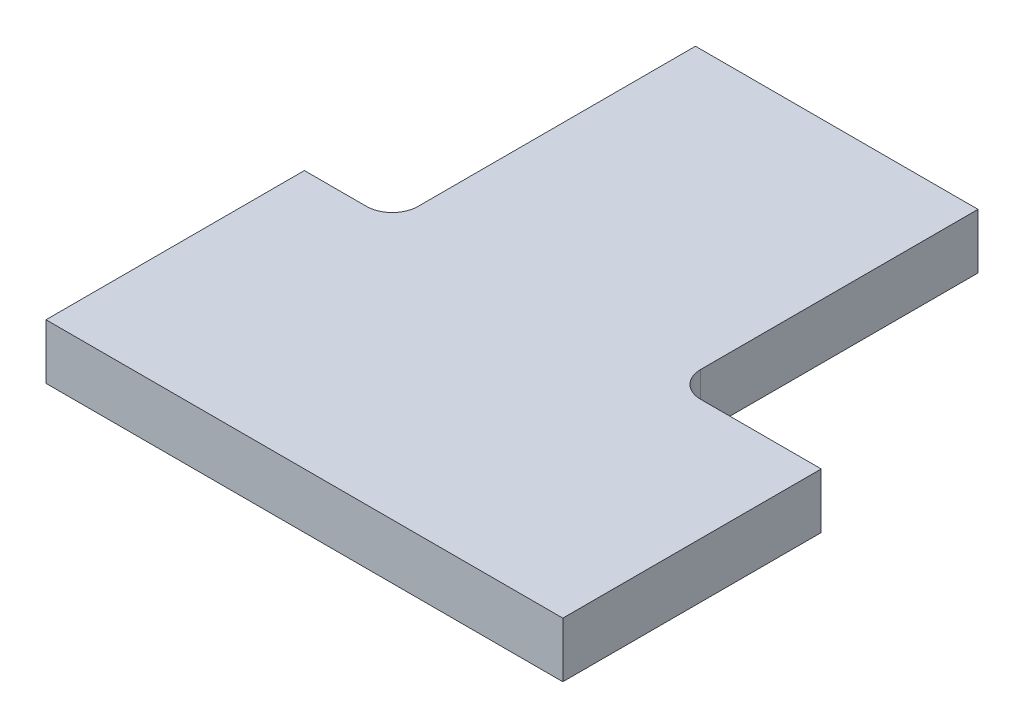
from build123d import *

# Parameters (mm, degrees)
AUFSATZ_LINEAR_AUSTRAGEN1_DEPTH = 1.6


with BuildPart() as part:
    # Skizze1 → Aufsatz-Linear austragen1 (new body)
    with BuildSketch(Plane(origin=(0, 0, 0), x_dir=(1, 0, 0), z_dir=(0, 1, 0))):
        with BuildLine():
            Line((4.85, 3.75), (4, 3.75))
            ThreePointArc((4, 3.75), (3.469669914, 3.969669914), (3.25, 4.5))
            Line((3.25, 4.5), (3.25, 12.55))
            Line((3.25, 12.55), (-4.95, 12.55))
            Line((-4.95, 12.55), (-4.95, 4.5))
            ThreePointArc((-4.95, 4.5), (-5.169669914, 3.969669914), (-5.7, 3.75))
            Line((-5.7, 3.75), (-7.5, 3.75))
            Line((-7.5, 3.75), (-7.5, -3.75))
            Line((-7.5, -3.75), (7.5, -3.75))
            Line((7.5, -3.75), (7.5, 3.75))
            Line((7.5, 3.75), (4.85, 3.75))
        make_face()
    extrude(amount=AUFSATZ_LINEAR_AUSTRAGEN1_DEPTH)


solid = part.part
